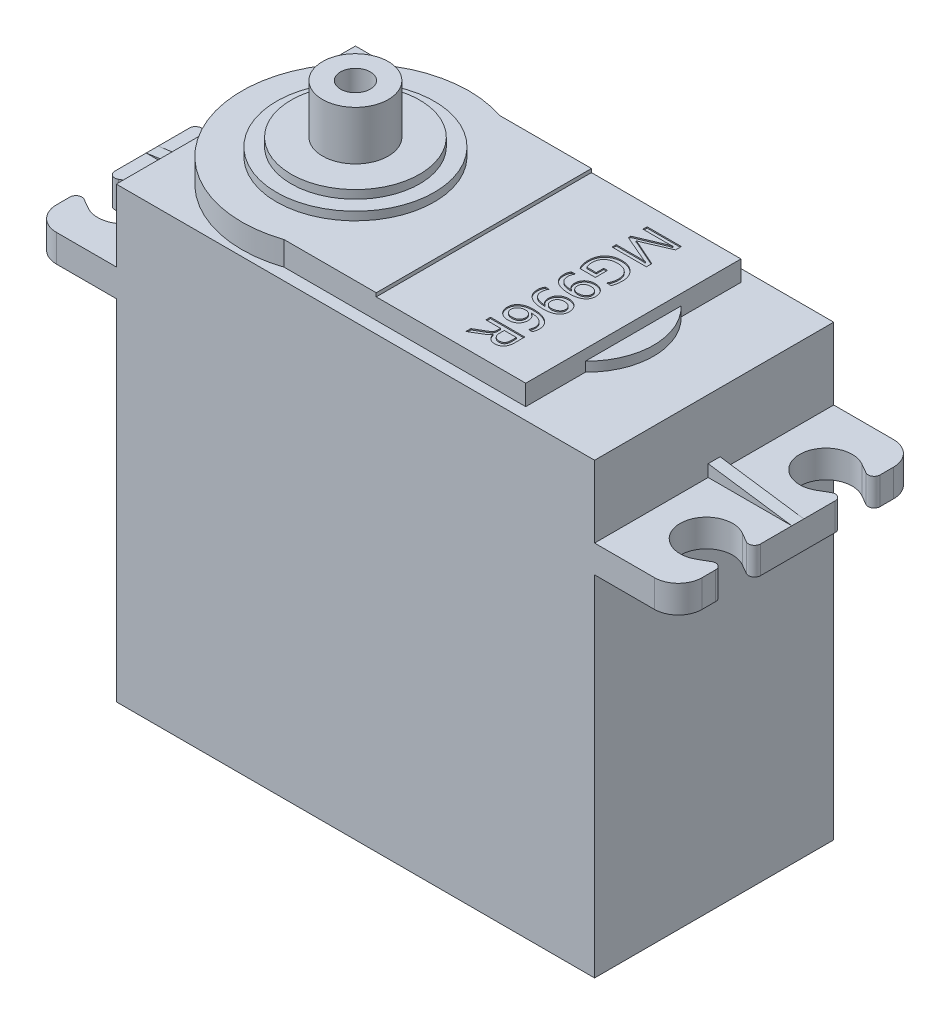
from build123d import *

# Parameters (mm, degrees)
SKETCH_1_W          = 40
SKETCH_1_H          = 20
EXTRUDE_1_DEPTH     = 37.5
EXTRUDE_2_DEPTH     = 2.3
CUT_EXTRUDE_1_REACH = 51.611
EXTRUDE_3_DEPTH     = 0.5
EXTRUDE_4_DEPTH     = 2
SKETCH_9_W          = 12.5
SKETCH_9_H          = 18
EXTRUDE_5_DEPTH     = 1.7
EXTRUDE_6_DEPTH     = 0.8
SKETCH_11_R         = 6.6
EXTRUDE_7_DEPTH     = 0.7
SKETCH_12_R         = 5.375
EXTRUDE_8_DEPTH     = 0.7
SKETCH_13_R         = 2.75
SKETCH_13_R_2       = 1.25
EXTRUDE_9_DEPTH     = 4.1
SKETCH_14_W         = 7
SKETCH_14_H         = 2.5
EXTRUDE_10_DEPTH    = 5
CUT_EXTRUDE_2_DEPTH = 0.1


with BuildPart() as part:
    # 草图1 → 凸台-拉伸1 (new body)
    with BuildSketch(Plane(origin=(0, 0, 0), x_dir=(1, 0, 0), z_dir=(0, 1, 0))):
        with Locations((10, 0)):
            Rectangle(SKETCH_1_W, SKETCH_1_H)
    extrude(amount=EXTRUDE_1_DEPTH)

    # 草图2 → 凸台-拉伸2 (add)
    with BuildSketch(Plane(origin=(0, 31.5, 0), x_dir=(1, 0, 0), z_dir=(0, 1, 0))):
        with BuildLine():
            Line((-10, 10), (-15, 10))
            ThreePointArc((-15, 10), (-16.414213562, 9.414213562), (-17, 8))
            Line((-17, 8), (-17, -8))
            ThreePointArc((-17, -8), (-16.414213562, -9.414213562), (-15, -10))
            Line((-15, -10), (-10, -10))
            Line((-10, -10), (-10, 10))
        make_face()
        with BuildLine():
            Line((37, 8), (37, -8))
            ThreePointArc((37, -8), (36.414213562, -9.414213562), (35, -10))
            Line((35, -10), (30, -10))
            Line((30, -10), (30, 10))
            Line((30, 10), (35, 10))
            ThreePointArc((35, 10), (36.414213562, 9.414213562), (37, 8))
        make_face()
    extrude(amount=-EXTRUDE_2_DEPTH)

    # 草图3 → 切除-拉伸1 (cut, up to next)
    with BuildSketch(Plane(origin=(0, 31.5, 0), x_dir=(1, 0, 0), z_dir=(0, 1, 0)), mode=Mode.PRIVATE) as cut_extrude_1_sk1:
        with BuildLine():
            Line((-16.25, 3.556624327), (-15.45, 3.094744112))
            ThreePointArc((-15.45, 3.094744112), (-12.15, 5), (-15.45, 6.905255888))
            Line((-15.45, 6.905255888), (-16.25, 6.443375673))
            ThreePointArc((-16.25, 6.443375673), (-16.75, 6.443375673), (-17, 6.876388375))
            Line((-17, 6.876388375), (-17, 3.123611625))
            ThreePointArc((-17, 3.123611625), (-16.75, 3.556624327), (-16.25, 3.556624327))
        make_face()
    cut_extrude_1_tool1 = extrude(cut_extrude_1_sk1.sketch, amount=-CUT_EXTRUDE_1_REACH, mode=Mode.PRIVATE) & part.part
    # 草图3 → 切除-拉伸1 (cut, up to next)
    with BuildSketch(Plane(origin=(0, 31.5, 0), x_dir=(1, 0, 0), z_dir=(0, 1, 0)), mode=Mode.PRIVATE) as cut_extrude_1_sk2:
        with BuildLine():
            ThreePointArc((-16.25, -3.556624327), (-16.75, -3.556624327), (-17, -3.123611625))
            Line((-17, -3.123611625), (-17, -6.876388375))
            ThreePointArc((-17, -6.876388375), (-16.75, -6.443375673), (-16.25, -6.443375673))
            Line((-16.25, -6.443375673), (-15.45, -6.905255888))
            ThreePointArc((-15.45, -6.905255888), (-12.15, -5), (-15.45, -3.094744112))
            Line((-15.45, -3.094744112), (-16.25, -3.556624327))
        make_face()
    cut_extrude_1_tool2 = extrude(cut_extrude_1_sk2.sketch, amount=-CUT_EXTRUDE_1_REACH, mode=Mode.PRIVATE) & part.part
    # 草图3 → 切除-拉伸1 (cut, up to next)
    with BuildSketch(Plane(origin=(0, 31.5, 0), x_dir=(1, 0, 0), z_dir=(0, 1, 0)), mode=Mode.PRIVATE) as cut_extrude_1_sk3:
        with BuildLine():
            Line((36.25, -3.556624327), (35.45, -3.094744112))
            ThreePointArc((35.45, -3.094744112), (32.15, -5), (35.45, -6.905255888))
            Line((35.45, -6.905255888), (36.25, -6.443375673))
            ThreePointArc((36.25, -6.443375673), (36.75, -6.443375673), (37, -6.876388375))
            Line((37, -6.876388375), (37, -3.123611625))
            ThreePointArc((37, -3.123611625), (36.75, -3.556624327), (36.25, -3.556624327))
        make_face()
    cut_extrude_1_tool3 = extrude(cut_extrude_1_sk3.sketch, amount=-CUT_EXTRUDE_1_REACH, mode=Mode.PRIVATE) & part.part
    # 草图3 → 切除-拉伸1 (cut, up to next)
    with BuildSketch(Plane(origin=(0, 31.5, 0), x_dir=(1, 0, 0), z_dir=(0, 1, 0)), mode=Mode.PRIVATE) as cut_extrude_1_sk4:
        with BuildLine():
            Line((37, 3.123611625), (37, 6.876388375))
            ThreePointArc((37, 6.876388375), (36.75, 6.443375673), (36.25, 6.443375673))
            Line((36.25, 6.443375673), (35.45, 6.905255888))
            ThreePointArc((35.45, 6.905255888), (32.15, 5), (35.45, 3.094744112))
            Line((35.45, 3.094744112), (36.25, 3.556624327))
            ThreePointArc((36.25, 3.556624327), (36.75, 3.556624327), (37, 3.123611625))
        make_face()
    cut_extrude_1_tool4 = extrude(cut_extrude_1_sk4.sketch, amount=-CUT_EXTRUDE_1_REACH, mode=Mode.PRIVATE) & part.part
    add(cut_extrude_1_tool1.solids().sort_by_distance((-14.604409, 31.5, -5))[0], mode=Mode.SUBTRACT)
    add(cut_extrude_1_tool2.solids().sort_by_distance((-14.604409, 31.5, 5))[0], mode=Mode.SUBTRACT)
    add(cut_extrude_1_tool3.solids().sort_by_distance((34.604409, 31.5, 5))[0], mode=Mode.SUBTRACT)
    add(cut_extrude_1_tool4.solids().sort_by_distance((34.604409, 31.5, -5))[0], mode=Mode.SUBTRACT)

    # 草图5 → 凸台-拉伸3 (add, symmetric)
    with BuildSketch(Plane.XY):
        Polygon((-10, 31.5), (-10, 32.5), (-17, 31.5), align=None)
        Polygon((37, 31.5), (30, 31.5), (30, 32.5), align=None)
    extrude(amount=EXTRUDE_3_DEPTH, both=True)

    # 草图8 → 凸台-拉伸4 (add)
    with BuildSketch(Plane(origin=(0, 37.5, 0), x_dir=(1, 0, 0), z_dir=(0, 1, 0))):
        with BuildLine():
            Line((10.741381265, -9), (10.741381265, 9))
            Line((10.741381265, 9), (3.041381265, 9))
            ThreePointArc((3.041381265, 9), (-9.5, 0), (3.041381265, -9))
            Line((3.041381265, -9), (10.741381265, -9))
        make_face()
    extrude(amount=EXTRUDE_4_DEPTH)

    # 草图9 → 凸台-拉伸5 (add)
    with BuildSketch(Plane(origin=(0, 37.5, 0), x_dir=(1, 0, 0), z_dir=(0, 1, 0))):
        with Locations((16.991381265, 0)):
            Rectangle(SKETCH_9_W, SKETCH_9_H)
    extrude(amount=EXTRUDE_5_DEPTH)

    # 草图10 → 凸台-拉伸6 (add)
    with BuildSketch(Plane(origin=(0, 37.5, 0), x_dir=(1, 0, 0), z_dir=(0, 1, 0))):
        with BuildLine():
            Line((23.241381265, 4), (23.241381265, -4))
            ThreePointArc((23.241381265, -4), (24.941381265, 0), (23.241381265, 4))
        make_face()
    extrude(amount=EXTRUDE_6_DEPTH)

    # 草图11 → 凸台-拉伸7 (add)
    with BuildSketch(Plane(origin=(0, 39.5, 0), x_dir=(1, 0, 0), z_dir=(0, 1, 0))):
        Circle(SKETCH_11_R)
    extrude(amount=EXTRUDE_7_DEPTH)

    # 草图12 → 凸台-拉伸8 (add)
    with BuildSketch(Plane(origin=(0, 40.2, 0), x_dir=(1, 0, 0), z_dir=(0, 1, 0))):
        Circle(SKETCH_12_R)
    extrude(amount=EXTRUDE_8_DEPTH)

    # 草图13 → 凸台-拉伸9 (add)
    with BuildSketch(Plane(origin=(0, 40.9, 0), x_dir=(1, 0, 0), z_dir=(0, 1, 0))):
        Circle(SKETCH_13_R)
        Circle(SKETCH_13_R_2, mode=Mode.SUBTRACT)
    extrude(amount=EXTRUDE_9_DEPTH)

    # 草图14 → 凸台-拉伸10 (add)
    with BuildSketch(Plane.ZY.offset(10)):
        with Locations((0, 5.45)):
            Rectangle(SKETCH_14_W, SKETCH_14_H)
    extrude(amount=EXTRUDE_10_DEPTH)

    # 草图15 → 切除-拉伸2 (cut)
    # profile 1 of 6: a face of its own
    with BuildSketch(Plane(origin=(0, 39.2, 0), x_dir=(1, 0, 0), z_dir=(0, 1, 0))):
        with BuildLine():
            Line((16.991381265, 4.820906972), (18.90347786, 4.820906972))
            add(Edge.make_bspline(
                [(18.90347786, 4.820906972), (18.944785821, 4.820602076), (19.031619537, 4.81996115), (19.167731971, 4.813944454), (19.315863325, 4.805322095), (19.418404861, 4.797259538), (19.471702968, 4.793068855)],
                knots=[0, 0, 0, 0, 0.871045541, 1.831030101, 2.872632534, 4, 4, 4, 4], degree=3))
            Line((19.471702968, 4.793068855), (19.471702968, 4.802348227))
            add(Edge.make_bspline(
                [(19.471702968, 4.802348227), (19.439450558, 4.80998736), (19.380222909, 4.824015702), (19.299536507, 4.845848836), (19.234457736, 4.865853175), (19.197068666, 4.880927735), (19.180767346, 4.887500117)],
                knots=[0, 0, 0, 0, 1.310468131, 2.406516137, 3.305254436, 4, 4, 4, 4], degree=3))
            Line((19.180767346, 4.887500117), (16.991381265, 5.833996119))
            Line((16.991381265, 5.833996119), (16.991381265, 6.04360077))
            Line((16.991381265, 6.04360077), (19.164391983, 6.972629718))
            add(Edge.make_bspline(
                [(19.164391983, 6.972629718), (19.17146746, 6.97559055), (19.186931899, 6.982061862), (19.212863799, 6.991539924), (19.244081475, 7.000308192), (19.279982733, 7.010933396), (19.320978995, 7.021667165), (19.366747321, 7.033318256), (19.417682365, 7.044423493), (19.453150832, 7.052477295), (19.471702968, 7.056689916)],
                knots=[0, 0, 0, 0, 0.577058856, 1.261242383, 2.075487777, 3.015664153, 4.078227724, 5.263505528, 6.568649248, 8, 8, 8, 8], degree=3))
            Line((19.471702968, 7.056689916), (19.471702968, 7.067606825))
            add(Edge.make_bspline(
                [(19.471702968, 7.067606825), (19.454056417, 7.066645912), (19.416774757, 7.064615802), (19.357814195, 7.062490703), (19.293211356, 7.061072211), (19.222805402, 7.059178772), (19.146923981, 7.058378339), (19.065233903, 7.057065337), (18.977895284, 7.056585532), (18.917669817, 7.056654359), (18.886556651, 7.056689916)],
                knots=[0, 0, 0, 0, 0.72463438, 1.530926509, 2.41901435, 3.374227338, 4.418811281, 5.530533762, 6.724245498, 8, 8, 8, 8], degree=3))
            Line((18.886556651, 7.056689916), (16.991381265, 7.056689916))
            Line((16.991381265, 7.056689916), (16.991381265, 7.406031001))
            Line((16.991381265, 7.406031001), (19.855978162, 7.406031001))
            Line((19.855978162, 7.406031001), (19.855978162, 6.916953482))
            Line((19.855978162, 6.916953482), (17.900213931, 6.069255506))
            add(Edge.make_bspline(
                [(17.900213931, 6.069255506), (17.864843294, 6.05423999), (17.79882865, 6.026215504), (17.704778738, 5.991032545), (17.624078689, 5.961586538), (17.573343512, 5.947787665), (17.550327001, 5.941527672)],
                knots=[0, 0, 0, 0, 1.236723759, 2.308182252, 3.232490273, 4, 4, 4, 4], degree=3))
            Line((17.550327001, 5.941527672), (17.550327001, 5.928427381))
            add(Edge.make_bspline(
                [(17.550327001, 5.928427381), (17.571424031, 5.920579321), (17.611782064, 5.905566199), (17.669765881, 5.884430922), (17.722287226, 5.864614142), (17.769674059, 5.846808157), (17.811573277, 5.83027551), (17.848423533, 5.816148805), (17.879825961, 5.803585978), (17.899120014, 5.795963217), (17.907855768, 5.792511865)],
                knots=[0, 0, 0, 0, 1.412333924, 2.701755703, 3.872234093, 4.93449088, 5.877898284, 6.698355401, 7.41065537, 8, 8, 8, 8], degree=3))
            Line((17.907855768, 5.792511865), (19.855978162, 4.925709298))
            Line((19.855978162, 4.925709298), (19.855978162, 4.471565888))
            Line((19.855978162, 4.471565888), (16.991381265, 4.471565888))
            Line((16.991381265, 4.471565888), (16.991381265, 4.820906972))
        make_face()
    # profile 2 of 6: a face of its own
    with BuildSketch(Plane(origin=(0, 39.2, 0), x_dir=(1, 0, 0), z_dir=(0, 1, 0))):
        with BuildLine():
            add(Edge.make_bspline(
                [(17.197164998, 1.572034882), (17.177943098, 1.608003366), (17.139515576, 1.679909876), (17.090438998, 1.792278061), (17.048932186, 1.908099462), (17.015066956, 2.027372077), (16.98878819, 2.149907572), (16.970513789, 2.275926743), (16.958549803, 2.405310031), (16.957153045, 2.492849343), (16.956447157, 2.53708963)],
                knots=[0, 0, 0, 0, 0.972956917, 1.945089931, 2.922975691, 3.907088372, 4.901795918, 5.911328761, 6.94443522, 8, 8, 8, 8], degree=3))
            add(Edge.make_bspline(
                [(16.956447157, 2.53708963), (16.957483672, 2.587372103), (16.959515312, 2.685929076), (16.97886316, 2.829809377), (17.008304229, 2.966536215), (17.05097799, 3.095636325), (17.106707095, 3.216791536), (17.173282371, 3.33123938), (17.253093934, 3.437516993), (17.344279187, 3.535655705), (17.445391271, 3.624489884), (17.555739995, 3.701958559), (17.674510244, 3.767040807), (17.800907779, 3.820932892), (17.9359781, 3.861519035), (18.07849407, 3.891738442), (18.229652774, 3.909202047), (18.333024604, 3.911461753), (18.386016378, 3.912620152)],
                knots=[0, 0, 0, 0, 1.078644858, 2.114215231, 3.110006391, 4.076918197, 5.025785053, 5.967440748, 6.913241114, 7.872075912, 8.837851529, 9.796630661, 10.759654955, 11.739538243, 12.740095881, 13.78169353, 14.862823715, 16, 16, 16, 16], degree=3))
            add(Edge.make_bspline(
                [(18.386016378, 3.912620152), (18.439753146, 3.911417874), (18.545052176, 3.909061971), (18.699284205, 3.88892114), (18.846001566, 3.856265279), (18.985769807, 3.81103575), (19.11793998, 3.751668753), (19.242770351, 3.679296657), (19.36056687, 3.594309231), (19.468850195, 3.496050301), (19.567921393, 3.388747201), (19.65492779, 3.273079072), (19.727867557, 3.149382342), (19.787541476, 3.018335314), (19.834051218, 2.880030258), (19.867385638, 2.734537548), (19.887290692, 2.581675646), (19.889689833, 2.477288259), (19.89091227, 2.424099622)],
                knots=[0, 0, 0, 0, 1.086135263, 2.128319124, 3.138636128, 4.121667084, 5.093204255, 6.062391405, 7.034457767, 8.024314098, 9.013678113, 9.983402714, 10.944921425, 11.911269802, 12.889636454, 13.890005454, 14.92489184, 16, 16, 16, 16], degree=3))
            add(Edge.make_bspline(
                [(19.89091227, 2.424099622), (19.890559468, 2.386423346), (19.88986514, 2.312274862), (19.882431337, 2.20338058), (19.871334175, 2.098758749), (19.854753191, 1.998794392), (19.834343538, 1.902996114), (19.808409321, 1.811810253), (19.77891761, 1.724544639), (19.75449684, 1.669214868), (19.742442309, 1.641903099)],
                knots=[0, 0, 0, 0, 1.126842671, 2.217673442, 3.26348751, 4.272790695, 5.247453918, 6.191690212, 7.107385799, 8, 8, 8, 8], degree=3))
            Line((19.742442309, 1.641903099), (19.358167116, 1.641903099))
            add(Edge.make_bspline(
                [(19.358167116, 1.641903099), (19.375775478, 1.67091846), (19.410999293, 1.728960867), (19.454938804, 1.821460116), (19.492834866, 1.917486937), (19.523181444, 2.017796213), (19.547514752, 2.121852398), (19.564014828, 2.230270321), (19.574853153, 2.342729179), (19.575949178, 2.419161008), (19.576505294, 2.45794204)],
                knots=[0, 0, 0, 0, 0.950725749, 1.90183437, 2.865870166, 3.841809745, 4.836370993, 5.858387711, 6.913359333, 8, 8, 8, 8], degree=3))
            add(Edge.make_bspline(
                [(19.576505294, 2.45794204), (19.575655871, 2.496024802), (19.573990456, 2.570691456), (19.558110534, 2.680000412), (19.533104099, 2.784233858), (19.498283659, 2.883626413), (19.452437352, 2.977489154), (19.397168473, 3.066329014), (19.331591113, 3.149900673), (19.256454389, 3.227447372), (19.173563678, 3.298258155), (19.083130515, 3.359712199), (18.986943329, 3.412357019), (18.883978476, 3.455291986), (18.774450085, 3.48771634), (18.658652212, 3.51111746), (18.536669274, 3.525548489), (18.453195514, 3.527399802), (18.410579423, 3.528344958)],
                knots=[0, 0, 0, 0, 1.028083989, 2.015704404, 2.976437228, 3.919933104, 4.854077463, 5.792285161, 6.740988825, 7.717641351, 8.704332033, 9.680329, 10.665586668, 11.661341596, 12.687520919, 13.745795982, 14.849154938, 16, 16, 16, 16], degree=3))
            add(Edge.make_bspline(
                [(18.410579423, 3.528344958), (18.366876091, 3.527559858), (18.281629375, 3.526028459), (18.157746997, 3.512617224), (18.041206108, 3.491612333), (17.931943567, 3.46178139), (17.830203847, 3.422348156), (17.735791687, 3.374747771), (17.648587853, 3.318967112), (17.570207743, 3.253668078), (17.499644336, 3.181706963), (17.438030099, 3.103345994), (17.386414745, 3.018583282), (17.344374159, 2.927828137), (17.310645056, 2.831238769), (17.287521812, 2.728315151), (17.273760121, 2.619340162), (17.27183939, 2.544772486), (17.270854133, 2.506522285)],
                knots=[0, 0, 0, 0, 1.21008622, 2.36036639, 3.446609172, 4.487011279, 5.492081308, 6.463398055, 7.411094352, 8.352459205, 9.282534545, 10.197858517, 11.107044583, 12.024599146, 12.963262571, 13.935102051, 14.940790899, 16, 16, 16, 16], degree=3))
            add(Edge.make_bspline(
                [(17.270854133, 2.506522285), (17.271298006, 2.480127894), (17.272171603, 2.428180442), (17.278335256, 2.351654443), (17.287965559, 2.27818874), (17.301650694, 2.207596393), (17.31949403, 2.140284361), (17.341572478, 2.075985554), (17.367001308, 2.014555075), (17.38737253, 1.975638644), (17.397490276, 1.956310076)],
                knots=[0, 0, 0, 0, 1.110065811, 2.184747887, 3.227007212, 4.225063257, 5.207029156, 6.153277384, 7.082790902, 8, 8, 8, 8], degree=3))
            Line((17.397490276, 1.956310076), (18.179140954, 1.956310076))
            Line((18.179140954, 1.956310076), (18.179140954, 2.585124029))
            Line((18.179140954, 2.585124029), (18.49354793, 2.585124029))
            Line((18.49354793, 2.585124029), (18.49354793, 1.572034882))
            Line((18.49354793, 1.572034882), (17.197164998, 1.572034882))
        make_face()
    # profile 3 of 6: a face of its own
    with BuildSketch(Plane(origin=(0, 39.2, 0), x_dir=(1, 0, 0), z_dir=(0, 1, 0))):
        with BuildLine():
            add(Edge.make_bspline(
                [(17.419324094, 0.978155038), (17.407364808, 0.958496955), (17.383684775, 0.919572889), (17.353934781, 0.858562657), (17.327799447, 0.79679044), (17.307468649, 0.733460225), (17.290582313, 0.669230301), (17.279564407, 0.60381297), (17.271903081, 0.537293759), (17.271206021, 0.4925569), (17.270854133, 0.469972928)],
                knots=[0, 0, 0, 0, 1.028585653, 2.036655077, 3.032564308, 4.025876988, 5.00876855, 6.000112653, 6.990420851, 8, 8, 8, 8], degree=3))
            add(Edge.make_bspline(
                [(17.270854133, 0.469972928), (17.271528286, 0.438794842), (17.272840801, 0.378093909), (17.287835298, 0.289932516), (17.310357689, 0.20696574), (17.342801526, 0.129318688), (17.384680307, 0.057387795), (17.435454942, -0.009527866), (17.495764545, -0.070589779), (17.565060431, -0.126013797), (17.64295568, -0.174859323), (17.728285646, -0.218246376), (17.82184703, -0.254206345), (17.922968217, -0.28319483), (18.031547297, -0.307055449), (18.148012461, -0.322828496), (18.27212029, -0.332882667), (18.357429588, -0.334018932), (18.40130005, -0.334603258)],
                knots=[0, 0, 0, 0, 0.954567611, 1.858457354, 2.732422706, 3.584719473, 4.429228195, 5.276824037, 6.152193579, 7.052654035, 7.990113814, 8.965178141, 9.98206079, 11.056699865, 12.186517323, 13.385963841, 14.655727156, 16, 16, 16, 16], degree=3))
            add(Edge.make_bspline(
                [(18.40130005, -0.334603258), (18.400444358, -0.333320513), (18.398834945, -0.330907888), (18.400513806, -0.328591894), (18.40130005, -0.327507267)],
                knots=[0, 0, 0, 0, 1.063360139, 2, 2, 2, 2], degree=3))
            add(Edge.make_bspline(
                [(18.40130005, -0.327507267), (18.372590231, -0.311555121), (18.316442545, -0.280357568), (18.242390035, -0.221156348), (18.179010056, -0.154620112), (18.127975332, -0.079341884), (18.087515102, 0.003442401), (18.059437893, 0.094391348), (18.042111123, 0.193113458), (18.040326647, 0.261566727), (18.03940452, 0.296939922)],
                knots=[0, 0, 0, 0, 1.030533739, 2.015410951, 2.965883311, 3.907857419, 4.861625629, 5.850725502, 6.889363418, 8, 8, 8, 8], degree=3))
            add(Edge.make_bspline(
                [(18.03940452, 0.296939922), (18.040126812, 0.32590446), (18.041545482, 0.382794331), (18.053072781, 0.466279957), (18.07303546, 0.545662683), (18.09951643, 0.621701873), (18.135039212, 0.693549079), (18.177487953, 0.76201429), (18.228268602, 0.826207934), (18.285919562, 0.885917508), (18.349541927, 0.940440662), (18.418542133, 0.988274624), (18.492692128, 1.028084585), (18.571119892, 1.060924774), (18.654026566, 1.086870508), (18.741674409, 1.104466146), (18.833863076, 1.115732311), (18.896893667, 1.117160818), (18.929132596, 1.117891472)],
                knots=[0, 0, 0, 0, 1.024075968, 2.011409591, 2.972737173, 3.915012034, 4.853147525, 5.801204611, 6.758907623, 7.741849386, 8.732197648, 9.717432345, 10.704954653, 11.702799665, 12.720386372, 13.771575185, 14.860203789, 16, 16, 16, 16], degree=3))
            add(Edge.make_bspline(
                [(18.929132596, 1.117891472), (18.963373759, 1.117220031), (19.030620106, 1.115901387), (19.129115831, 1.103690876), (19.222951265, 1.083383971), (19.312305359, 1.055735895), (19.396873451, 1.019592966), (19.476349342, 0.974900341), (19.551625555, 0.923031168), (19.620984874, 0.863042848), (19.684313162, 0.797293939), (19.739870136, 0.726117445), (19.786445815, 0.64961675), (19.824880193, 0.568630662), (19.854379222, 0.482703752), (19.875732479, 0.39223545), (19.888360875, 0.296932459), (19.89005131, 0.231840111), (19.89091227, 0.198687742)],
                knots=[0, 0, 0, 0, 1.100355813, 2.160992814, 3.184300223, 4.183247733, 5.163214011, 6.134660359, 7.109762209, 8.096893554, 9.077296099, 10.040164893, 10.993123417, 11.950701635, 12.916249136, 13.907909978, 14.934471686, 16, 16, 16, 16], degree=3))
            add(Edge.make_bspline(
                [(19.89091227, 0.198687742), (19.889814321, 0.164428608), (19.887671288, 0.097559875), (19.87236885, -3.9446e-05), (19.84581303, -0.091671316), (19.809989946, -0.178236528), (19.762475053, -0.258464468), (19.704495097, -0.332718407), (19.636365784, -0.40128818), (19.557840144, -0.463517871), (19.46974124, -0.519318456), (19.371687018, -0.567322578), (19.264445718, -0.608232579), (19.147623888, -0.641164673), (19.021621403, -0.667434012), (18.886086829, -0.685591936), (18.740996966, -0.696525227), (18.641128127, -0.697948209), (18.589616729, -0.69868217)],
                knots=[0, 0, 0, 0, 0.92240419, 1.800395753, 2.651735748, 3.486158885, 4.316356776, 5.154296614, 6.016952827, 6.912968287, 7.846765804, 8.819630126, 9.847832232, 10.933373702, 12.08453234, 13.310968928, 14.61302334, 16, 16, 16, 16], degree=3))
            add(Edge.make_bspline(
                [(18.589616729, -0.69868217), (18.52590289, -0.697811206), (18.402116557, -0.696119054), (18.222237494, -0.681001837), (18.053499863, -0.657475851), (17.896121187, -0.623955473), (17.749977389, -0.580350528), (17.615223312, -0.526729875), (17.491151953, -0.464363241), (17.379341029, -0.391390772), (17.279794611, -0.310287678), (17.193126599, -0.221215628), (17.119854617, -0.124464927), (17.060034678, -0.020032946), (17.013237466, 0.091799576), (16.980015832, 0.210937956), (16.959988986, 0.337564177), (16.957646578, 0.42441142), (16.956447157, 0.468881237)],
                knots=[0, 0, 0, 0, 1.35028008, 2.623389572, 3.823303126, 4.959469995, 6.03073553, 7.051988269, 8.029948387, 8.969148067, 9.876285298, 10.746329479, 11.597116086, 12.441902515, 13.290667489, 14.160001915, 15.057835605, 16, 16, 16, 16], degree=3))
            add(Edge.make_bspline(
                [(16.956447157, 0.468881237), (16.956800386, 0.493463867), (16.957495309, 0.54182629), (16.964926903, 0.61274474), (16.976179355, 0.681038821), (16.9926513, 0.746306622), (17.013126252, 0.808938523), (17.039385957, 0.868131193), (17.068798053, 0.925251965), (17.092897994, 0.9605508), (17.104917118, 0.978155038)],
                knots=[0, 0, 0, 0, 1.093805841, 2.151889375, 3.170429105, 4.172184366, 5.145378569, 6.09927475, 7.052070148, 8, 8, 8, 8], degree=3))
            Line((17.104917118, 0.978155038), (17.419324094, 0.978155038))
        make_face()
        with BuildLine():
            add(Edge.make_bspline(
                [(18.97061685, 0.733616278), (18.947496689, 0.733200973), (18.902432633, 0.732391492), (18.836667213, 0.725992006), (18.774918245, 0.714258287), (18.71646966, 0.699293927), (18.661879712, 0.678980684), (18.6107949, 0.654447811), (18.563541529, 0.625196256), (18.519937819, 0.5922227), (18.480889567, 0.554882865), (18.446970172, 0.51374088), (18.41797749, 0.469485023), (18.393900625, 0.421833555), (18.376398469, 0.370452539), (18.363017568, 0.316068352), (18.355423651, 0.258216188), (18.354358944, 0.218541638), (18.353811497, 0.198141897)],
                knots=[0, 0, 0, 0, 1.201614023, 2.342094608, 3.429014088, 4.465821748, 5.474161983, 6.451195725, 7.40652364, 8.357911654, 9.287620349, 10.207853812, 11.123264036, 12.032547768, 12.97467861, 13.938023664, 14.939779185, 16, 16, 16, 16], degree=3))
            add(Edge.make_bspline(
                [(18.353811497, 0.198141897), (18.35416221, 0.180284285), (18.3548487, 0.145329634), (18.36229245, 0.093960655), (18.374024492, 0.044849962), (18.391369281, -0.001988907), (18.412666672, -0.046773437), (18.438143361, -0.089892803), (18.470020247, -0.129571972), (18.504839818, -0.167793694), (18.544081899, -0.201629689), (18.585183217, -0.231970664), (18.628117301, -0.257879289), (18.673652055, -0.277901024), (18.720565544, -0.29472105), (18.770068957, -0.305846321), (18.821370571, -0.313346119), (18.856325546, -0.314050681), (18.874002206, -0.314406976)],
                knots=[0, 0, 0, 0, 1.052405084, 2.059987197, 3.054110504, 4.024913866, 4.999209444, 5.97633694, 6.970112753, 7.995084367, 9.021627336, 10.019565095, 11.005898532, 11.971171561, 12.948475779, 13.94010602, 14.95831579, 16, 16, 16, 16], degree=3))
            add(Edge.make_bspline(
                [(18.874002206, -0.314406976), (18.89876524, -0.314047726), (18.947487702, -0.313340884), (19.018791875, -0.306010992), (19.086817517, -0.294596454), (19.15156521, -0.278993177), (19.212921101, -0.257888263), (19.2714876, -0.23319111), (19.326256422, -0.20277253), (19.377489867, -0.168575068), (19.424154151, -0.130821603), (19.465194058, -0.089740728), (19.499028992, -0.044937068), (19.527830951, 0.001963227), (19.54997049, 0.052249172), (19.565001767, 0.105560582), (19.574609185, 0.161589897), (19.575865776, 0.199921661), (19.576505294, 0.219429869)],
                knots=[0, 0, 0, 0, 1.20492916, 2.370756203, 3.484529756, 4.560627125, 5.608027333, 6.639469169, 7.65017253, 8.652303849, 9.634315796, 10.567389382, 11.470739043, 12.360750364, 13.241059671, 14.135159179, 15.050925415, 16, 16, 16, 16], degree=3))
            add(Edge.make_bspline(
                [(19.576505294, 0.219429869), (19.57600458, 0.237656084), (19.575022895, 0.27338984), (19.566585016, 0.325766916), (19.552864048, 0.37546873), (19.534388927, 0.423178698), (19.509312201, 0.467832256), (19.480002141, 0.511001619), (19.443923903, 0.550620445), (19.403771243, 0.588299619), (19.359473353, 0.622218326), (19.312032982, 0.652155989), (19.261782698, 0.676986833), (19.209012829, 0.698209607), (19.153110067, 0.713759524), (19.094702201, 0.725106045), (19.033582361, 0.732601423), (18.991927539, 0.733272801), (18.97061685, 0.733616278)],
                knots=[0, 0, 0, 0, 0.985572672, 1.932283465, 2.861223772, 3.771514896, 4.692230854, 5.626060628, 6.588202423, 7.584141594, 8.602020808, 9.601601628, 10.614088255, 11.6303956, 12.67421699, 13.747557175, 14.847645819, 16, 16, 16, 16], degree=3))
        make_face(mode=Mode.SUBTRACT)
    # profile 4 of 6: a face of its own
    with BuildSketch(Plane(origin=(0, 39.2, 0), x_dir=(1, 0, 0), z_dir=(0, 1, 0))):
        with BuildLine():
            add(Edge.make_bspline(
                [(17.419324094, -1.222693797), (17.407364808, -1.242351881), (17.383684775, -1.281275946), (17.353934781, -1.342286178), (17.327799447, -1.404058395), (17.307468649, -1.46738861), (17.290582313, -1.531618534), (17.279564407, -1.597035865), (17.271903081, -1.663555076), (17.271206021, -1.708291935), (17.270854133, -1.730875907)],
                knots=[0, 0, 0, 0, 1.028585653, 2.036655077, 3.032564308, 4.025876988, 5.00876855, 6.000112653, 6.990420851, 8, 8, 8, 8], degree=3))
            add(Edge.make_bspline(
                [(17.270854133, -1.730875907), (17.271528286, -1.762053994), (17.272840801, -1.822754926), (17.287835298, -1.910916319), (17.310357689, -1.993883095), (17.342801526, -2.071530147), (17.384680307, -2.143461041), (17.435454942, -2.210376701), (17.495764545, -2.271438614), (17.565060431, -2.326862633), (17.64295568, -2.375708159), (17.728285646, -2.419095211), (17.82184703, -2.45505518), (17.922968217, -2.484043665), (18.031547297, -2.507904285), (18.148012461, -2.523677331), (18.27212029, -2.533731502), (18.357429588, -2.534867767), (18.40130005, -2.535452093)],
                knots=[0, 0, 0, 0, 0.954567611, 1.858457354, 2.732422706, 3.584719473, 4.429228195, 5.276824037, 6.152193579, 7.052654035, 7.990113814, 8.965178141, 9.98206079, 11.056699865, 12.186517323, 13.385963841, 14.655727156, 16, 16, 16, 16], degree=3))
            add(Edge.make_bspline(
                [(18.40130005, -2.535452093), (18.400444358, -2.534169349), (18.398834945, -2.531756724), (18.400513806, -2.529440729), (18.40130005, -2.528356102)],
                knots=[0, 0, 0, 0, 1.063360139, 2, 2, 2, 2], degree=3))
            add(Edge.make_bspline(
                [(18.40130005, -2.528356102), (18.372590231, -2.512403956), (18.316442545, -2.481206404), (18.242390035, -2.422005184), (18.179010056, -2.355468948), (18.127975332, -2.280190719), (18.087515102, -2.197406434), (18.059437893, -2.106457487), (18.042111123, -2.007735377), (18.040326647, -1.939282108), (18.03940452, -1.903908913)],
                knots=[0, 0, 0, 0, 1.030533739, 2.015410951, 2.965883311, 3.907857419, 4.861625629, 5.850725502, 6.889363418, 8, 8, 8, 8], degree=3))
            add(Edge.make_bspline(
                [(18.03940452, -1.903908913), (18.040126812, -1.874944375), (18.041545482, -1.818054504), (18.053072781, -1.734568878), (18.07303546, -1.655186153), (18.09951643, -1.579146962), (18.135039212, -1.507299757), (18.177487953, -1.438834545), (18.228268602, -1.374640902), (18.285919562, -1.314931327), (18.349541927, -1.260408173), (18.418542133, -1.212574212), (18.492692128, -1.17276425), (18.571119892, -1.139924061), (18.654026566, -1.113978327), (18.741674409, -1.096382689), (18.833863076, -1.085116524), (18.896893667, -1.083688017), (18.929132596, -1.082957363)],
                knots=[0, 0, 0, 0, 1.024075968, 2.011409591, 2.972737173, 3.915012034, 4.853147525, 5.801204611, 6.758907623, 7.741849386, 8.732197648, 9.717432345, 10.704954653, 11.702799665, 12.720386372, 13.771575185, 14.860203789, 16, 16, 16, 16], degree=3))
            add(Edge.make_bspline(
                [(18.929132596, -1.082957363), (18.963373759, -1.083628804), (19.030620106, -1.084947448), (19.129115831, -1.097157959), (19.222951265, -1.117464864), (19.312305359, -1.14511294), (19.396873451, -1.181255869), (19.476349342, -1.225948495), (19.551625555, -1.277817667), (19.620984874, -1.337805987), (19.684313162, -1.403554896), (19.739870136, -1.47473139), (19.786445815, -1.551232085), (19.824880193, -1.632218173), (19.854379222, -1.718145083), (19.875732479, -1.808613385), (19.888360875, -1.903916376), (19.89005131, -1.969008724), (19.89091227, -2.002161093)],
                knots=[0, 0, 0, 0, 1.100355813, 2.160992814, 3.184300223, 4.183247733, 5.163214011, 6.134660359, 7.109762209, 8.096893554, 9.077296099, 10.040164893, 10.993123417, 11.950701635, 12.916249136, 13.907909978, 14.934471686, 16, 16, 16, 16], degree=3))
            add(Edge.make_bspline(
                [(19.89091227, -2.002161093), (19.889814321, -2.036420227), (19.887671288, -2.10328896), (19.87236885, -2.200888282), (19.84581303, -2.292520151), (19.809989946, -2.379085363), (19.762475053, -2.459313303), (19.704495097, -2.533567242), (19.636365784, -2.602137015), (19.557840144, -2.664366707), (19.46974124, -2.720167291), (19.371687018, -2.768171413), (19.264445718, -2.809081414), (19.147623888, -2.842013508), (19.021621403, -2.868282847), (18.886086829, -2.886440771), (18.740996966, -2.897374062), (18.641128127, -2.898797044), (18.589616729, -2.899531005)],
                knots=[0, 0, 0, 0, 0.92240419, 1.800395753, 2.651735748, 3.486158885, 4.316356776, 5.154296614, 6.016952827, 6.912968287, 7.846765804, 8.819630126, 9.847832232, 10.933373702, 12.08453234, 13.310968928, 14.61302334, 16, 16, 16, 16], degree=3))
            add(Edge.make_bspline(
                [(18.589616729, -2.899531005), (18.52590289, -2.898660041), (18.402116557, -2.896967889), (18.222237494, -2.881850672), (18.053499863, -2.858324686), (17.896121187, -2.824804309), (17.749977389, -2.781199363), (17.615223312, -2.72757871), (17.491151953, -2.665212076), (17.379341029, -2.592239607), (17.279794611, -2.511136514), (17.193126599, -2.422064463), (17.119854617, -2.325313763), (17.060034678, -2.220881781), (17.013237466, -2.109049259), (16.980015832, -1.989910879), (16.959988986, -1.863284658), (16.957646578, -1.776437416), (16.956447157, -1.731967598)],
                knots=[0, 0, 0, 0, 1.35028008, 2.623389572, 3.823303126, 4.959469995, 6.03073553, 7.051988269, 8.029948387, 8.969148067, 9.876285298, 10.746329479, 11.597116086, 12.441902515, 13.290667489, 14.160001915, 15.057835605, 16, 16, 16, 16], degree=3))
            add(Edge.make_bspline(
                [(16.956447157, -1.731967598), (16.956800386, -1.707384968), (16.957495309, -1.659022546), (16.964926903, -1.588104096), (16.976179355, -1.519810015), (16.9926513, -1.454542213), (17.013126252, -1.391910312), (17.039385957, -1.332717642), (17.068798053, -1.27559687), (17.092897994, -1.240298035), (17.104917118, -1.222693797)],
                knots=[0, 0, 0, 0, 1.093805841, 2.151889375, 3.170429105, 4.172184366, 5.145378569, 6.09927475, 7.052070148, 8, 8, 8, 8], degree=3))
            Line((17.104917118, -1.222693797), (17.419324094, -1.222693797))
        make_face()
        with BuildLine():
            add(Edge.make_bspline(
                [(18.97061685, -1.467232557), (18.947496689, -1.467647862), (18.902432633, -1.468457343), (18.836667213, -1.47485683), (18.774918245, -1.486590548), (18.71646966, -1.501554908), (18.661879712, -1.521868151), (18.6107949, -1.546401024), (18.563541529, -1.575652579), (18.519937819, -1.608626136), (18.480889567, -1.64596597), (18.446970172, -1.687107955), (18.41797749, -1.731363812), (18.393900625, -1.77901528), (18.376398469, -1.830396296), (18.363017568, -1.884780483), (18.355423651, -1.942632648), (18.354358944, -1.982307197), (18.353811497, -2.002706939)],
                knots=[0, 0, 0, 0, 1.201614023, 2.342094608, 3.429014088, 4.465821748, 5.474161983, 6.451195725, 7.40652364, 8.357911654, 9.287620349, 10.207853812, 11.123264036, 12.032547768, 12.97467861, 13.938023664, 14.939779185, 16, 16, 16, 16], degree=3))
            add(Edge.make_bspline(
                [(18.353811497, -2.002706939), (18.35416221, -2.020564551), (18.3548487, -2.055519201), (18.36229245, -2.106888181), (18.374024492, -2.155998873), (18.391369281, -2.202837742), (18.412666672, -2.247622272), (18.438143361, -2.290741638), (18.470020247, -2.330420807), (18.504839818, -2.368642529), (18.544081899, -2.402478525), (18.585183217, -2.432819499), (18.628117301, -2.458728124), (18.673652055, -2.47874986), (18.720565544, -2.495569885), (18.770068957, -2.506695156), (18.821370571, -2.514194954), (18.856325546, -2.514899516), (18.874002206, -2.515255812)],
                knots=[0, 0, 0, 0, 1.052405084, 2.059987197, 3.054110504, 4.024913866, 4.999209444, 5.97633694, 6.970112753, 7.995084367, 9.021627336, 10.019565095, 11.005898532, 11.971171561, 12.948475779, 13.94010602, 14.95831579, 16, 16, 16, 16], degree=3))
            add(Edge.make_bspline(
                [(18.874002206, -2.515255812), (18.89876524, -2.514896561), (18.947487702, -2.514189719), (19.018791875, -2.506859827), (19.086817517, -2.49544529), (19.15156521, -2.479842013), (19.212921101, -2.458737098), (19.2714876, -2.434039945), (19.326256422, -2.403621365), (19.377489867, -2.369423903), (19.424154151, -2.331670439), (19.465194058, -2.290589563), (19.499028992, -2.245785903), (19.527830951, -2.198885609), (19.54997049, -2.148599663), (19.565001767, -2.095288253), (19.574609185, -2.039258939), (19.575865776, -2.000927175), (19.576505294, -1.981418966)],
                knots=[0, 0, 0, 0, 1.20492916, 2.370756203, 3.484529756, 4.560627125, 5.608027333, 6.639469169, 7.65017253, 8.652303849, 9.634315796, 10.567389382, 11.470739043, 12.360750364, 13.241059671, 14.135159179, 15.050925415, 16, 16, 16, 16], degree=3))
            add(Edge.make_bspline(
                [(19.576505294, -1.981418966), (19.57600458, -1.963192752), (19.575022895, -1.927458996), (19.566585016, -1.87508192), (19.552864048, -1.825380105), (19.534388927, -1.777670137), (19.509312201, -1.73301658), (19.480002141, -1.689847217), (19.443923903, -1.65022839), (19.403771243, -1.612549216), (19.359473353, -1.578630509), (19.312032982, -1.548692847), (19.261782698, -1.523862002), (19.209012829, -1.502639229), (19.153110067, -1.487089311), (19.094702201, -1.47574279), (19.033582361, -1.468247412), (18.991927539, -1.467576035), (18.97061685, -1.467232557)],
                knots=[0, 0, 0, 0, 0.985572672, 1.932283465, 2.861223772, 3.771514896, 4.692230854, 5.626060628, 6.588202423, 7.584141594, 8.602020808, 9.601601628, 10.614088255, 11.6303956, 12.67421699, 13.747557175, 14.847645819, 16, 16, 16, 16], degree=3))
        make_face(mode=Mode.SUBTRACT)
    # profile 5 of 6: a face of its own
    with BuildSketch(Plane(origin=(0, 39.2, 0), x_dir=(1, 0, 0), z_dir=(0, 1, 0))):
        with BuildLine():
            add(Edge.make_bspline(
                [(19.462969441, -4.995577515), (19.48050191, -4.957746774), (19.515313993, -4.882630893), (19.550037457, -4.763906567), (19.572527332, -4.642909471), (19.575175481, -4.561185312), (19.576505294, -4.520146132)],
                knots=[0, 0, 0, 0, 1.013543852, 2.012470203, 3.001928032, 4, 4, 4, 4], degree=3))
            add(Edge.make_bspline(
                [(19.576505294, -4.520146132), (19.575605148, -4.489335813), (19.573841966, -4.428985411), (19.558718944, -4.340986762), (19.534057302, -4.257762425), (19.499491612, -4.178900463), (19.454278071, -4.105094706), (19.399689679, -4.03548193), (19.334861236, -3.971190204), (19.260877988, -3.911719246), (19.17883228, -3.857738393), (19.0884039, -3.811351794), (18.991236925, -3.771606122), (18.886810189, -3.738748865), (18.775252955, -3.713311287), (18.656330552, -3.694932023), (18.530344689, -3.68335939), (18.443901264, -3.681557819), (18.399662514, -3.680635837)],
                knots=[0, 0, 0, 0, 0.913296431, 1.788939818, 2.639222758, 3.482489816, 4.33487651, 5.199609904, 6.100158379, 7.036504938, 8.010893577, 9.007723269, 10.045938113, 11.121177943, 12.250898554, 13.436220282, 14.68794636, 16, 16, 16, 16], degree=3))
            Line((18.399662514, -3.680635837), (18.399662514, -3.68991521))
            add(Edge.make_bspline(
                [(18.399662514, -3.68991521), (18.432005862, -3.707479304), (18.494859285, -3.741611931), (18.578682566, -3.805166662), (18.649763346, -3.876364924), (18.707924044, -3.955487288), (18.753310924, -4.042093438), (18.784876303, -4.136825618), (18.804332835, -4.238969397), (18.806726816, -4.309724645), (18.807954907, -4.346021435)],
                knots=[0, 0, 0, 0, 1.077964415, 2.094828084, 3.071894335, 4.018375507, 4.963336831, 5.926673543, 6.936402618, 8, 8, 8, 8], degree=3))
            add(Edge.make_bspline(
                [(18.807954907, -4.346021435), (18.807252816, -4.376624356), (18.805881057, -4.436416954), (18.794251787, -4.523644786), (18.774960906, -4.605984072), (18.749155218, -4.68408562), (18.714286278, -4.756850194), (18.672642283, -4.825421418), (18.622615757, -4.888630684), (18.565931945, -4.947227135), (18.502477166, -4.999303053), (18.434263836, -5.045640289), (18.360349966, -5.083724385), (18.281914795, -5.115739019), (18.198266304, -5.140097653), (18.109651111, -5.157349811), (18.016231434, -5.168778469), (17.952104288, -5.169750894), (17.919318522, -5.170248057)],
                knots=[0, 0, 0, 0, 1.074298639, 2.098986157, 3.083092859, 4.040774774, 4.981035408, 5.910247383, 6.852221309, 7.805567045, 8.767586811, 9.729797503, 10.69571313, 11.681643251, 12.700578092, 13.749343062, 14.849324875, 16, 16, 16, 16], degree=3))
            add(Edge.make_bspline(
                [(17.919318522, -5.170248057), (17.884893745, -5.169587538), (17.817462124, -5.168293707), (17.718804155, -5.155998364), (17.624847708, -5.135904227), (17.535685979, -5.107424311), (17.450946809, -5.071261271), (17.370910863, -5.02695681), (17.295945761, -4.974182776), (17.226151618, -4.914354436), (17.163222363, -4.848019434), (17.107605009, -4.776952361), (17.061069247, -4.701006862), (17.022331089, -4.620884784), (16.993185478, -4.535922061), (16.971589446, -4.446803306), (16.95900592, -4.353113033), (16.957310744, -4.2891089), (16.956447157, -4.256502782)],
                knots=[0, 0, 0, 0, 1.109861097, 2.174007738, 3.200701264, 4.204722214, 5.187931194, 6.16771933, 7.149403559, 8.139801315, 9.127692435, 10.093747355, 11.044857751, 11.995008189, 12.958207171, 13.936025103, 14.948533366, 16, 16, 16, 16], degree=3))
            add(Edge.make_bspline(
                [(16.956447157, -4.256502782), (16.957485708, -4.2209603), (16.959520276, -4.151331041), (16.97574899, -4.049905135), (17.001667173, -3.954087634), (17.039164259, -3.864489959), (17.08700242, -3.780885923), (17.145335504, -3.703156481), (17.214968259, -3.63207409), (17.294124389, -3.566392064), (17.38345982, -3.508159229), (17.481826367, -3.457156843), (17.589239179, -3.414257922), (17.70516904, -3.378863966), (17.829844787, -3.351525339), (17.963462228, -3.333130861), (18.105759432, -3.320584175), (18.203675123, -3.319365622), (18.25392178, -3.318740307)],
                knots=[0, 0, 0, 0, 0.944653107, 1.850616283, 2.723875085, 3.57834348, 4.425659775, 5.279086604, 6.154968211, 7.06555713, 8.008883694, 8.984797083, 10.00717675, 11.079962804, 12.204518309, 13.397077347, 14.664277788, 16, 16, 16, 16], degree=3))
            add(Edge.make_bspline(
                [(18.25392178, -3.318740307), (18.314913283, -3.319532264), (18.434020477, -3.321078835), (18.607743998, -3.337505966), (18.772139863, -3.362702992), (18.926857076, -3.398391383), (19.071681062, -3.445130782), (19.207327407, -3.500903179), (19.332765051, -3.568622904), (19.448293073, -3.645088932), (19.552285382, -3.73005225), (19.64279234, -3.822473252), (19.719553217, -3.921487343), (19.782263195, -4.027072156), (19.831399509, -4.139197714), (19.865562229, -4.258157203), (19.886946877, -4.383461131), (19.889573377, -4.469295115), (19.89091227, -4.513050141)],
                knots=[0, 0, 0, 0, 1.288921634, 2.517069323, 3.684985542, 4.802651449, 5.86936422, 6.898650367, 7.898424723, 8.877680848, 9.823205572, 10.731627575, 11.606326294, 12.465144358, 13.321176131, 14.186557521, 15.075573347, 16, 16, 16, 16], degree=3))
            add(Edge.make_bspline(
                [(19.89091227, -4.513050141), (19.890676159, -4.53799011), (19.890217111, -4.586478507), (19.884411581, -4.657145091), (19.876130953, -4.723766564), (19.863302264, -4.786223774), (19.847912133, -4.844804299), (19.827876175, -4.899002534), (19.805523227, -4.94967414), (19.786635344, -4.980477546), (19.777376418, -4.995577515)],
                knots=[0, 0, 0, 0, 1.191143447, 2.315826359, 3.385379422, 4.396279047, 5.359920202, 6.275596961, 7.154689832, 8, 8, 8, 8], degree=3))
            Line((19.777376418, -4.995577515), (19.462969441, -4.995577515))
        make_face()
        with BuildLine():
            add(Edge.make_bspline(
                [(17.943881567, -3.703015501), (17.921119521, -3.703380291), (17.876389304, -3.70409715), (17.810487416, -3.71138415), (17.747218493, -3.723443368), (17.686289022, -3.739605067), (17.628203883, -3.761238324), (17.572199528, -3.786844025), (17.518610844, -3.817447785), (17.468222158, -3.852736809), (17.4219449, -3.891457362), (17.381746383, -3.934130911), (17.346784086, -3.979167428), (17.319632693, -4.028658559), (17.29741647, -4.080439469), (17.282291711, -4.135734594), (17.272763062, -4.19376402), (17.271497792, -4.233539358), (17.270854133, -4.253773555)],
                knots=[0, 0, 0, 0, 1.124403757, 2.209591554, 3.27109502, 4.304860873, 5.320324349, 6.330040325, 7.344826972, 8.364936449, 9.366453672, 10.320392776, 11.257231747, 12.17502472, 13.101757445, 14.035398561, 15.000583413, 16, 16, 16, 16], degree=3))
            add(Edge.make_bspline(
                [(17.270854133, -4.253773555), (17.271328163, -4.273096016), (17.272253891, -4.310830673), (17.280987172, -4.365976219), (17.293624318, -4.41847737), (17.312639167, -4.468171064), (17.33641695, -4.515286564), (17.366582411, -4.559112144), (17.400742481, -4.600967676), (17.440946421, -4.638885015), (17.484712926, -4.673803233), (17.532400612, -4.703805192), (17.583088475, -4.729113153), (17.63669296, -4.749714422), (17.693216194, -4.76638912), (17.753036989, -4.777489677), (17.815783272, -4.784937003), (17.858707095, -4.785623372), (17.880563495, -4.785972864)],
                knots=[0, 0, 0, 0, 1.020616519, 1.993152711, 2.94487407, 3.87018094, 4.799278841, 5.727579917, 6.677014476, 7.649740876, 8.642609066, 9.632538182, 10.621812985, 11.632731025, 12.664524813, 13.732139934, 14.84522732, 16, 16, 16, 16], degree=3))
            add(Edge.make_bspline(
                [(17.880563495, -4.785972864), (17.904050416, -4.785573706), (17.949846242, -4.784795411), (18.016445627, -4.778186884), (18.079055566, -4.76734852), (18.137725532, -4.752146798), (18.192283843, -4.732452476), (18.243227275, -4.70907047), (18.289717693, -4.680393404), (18.332392986, -4.6478762), (18.370213044, -4.610826409), (18.403987583, -4.570723781), (18.431120823, -4.525599979), (18.454394977, -4.477721463), (18.471530041, -4.425662832), (18.485129659, -4.370470616), (18.491703715, -4.311243924), (18.492923469, -4.270706195), (18.49354793, -4.249952637)],
                knots=[0, 0, 0, 0, 1.218530796, 2.375944738, 3.468706994, 4.512957284, 5.516418192, 6.475223932, 7.416009989, 8.345116507, 9.253164876, 10.158608073, 11.057331746, 11.977956617, 12.915468053, 13.895605671, 14.922641392, 16, 16, 16, 16], degree=3))
            add(Edge.make_bspline(
                [(18.49354793, -4.249952637), (18.493004086, -4.230095116), (18.491937214, -4.191140155), (18.484157726, -4.134292467), (18.471625416, -4.080112669), (18.45379945, -4.02897482), (18.430311485, -3.980892849), (18.402729073, -3.935294599), (18.368924963, -3.893187121), (18.330982238, -3.854176454), (18.289541058, -3.818954568), (18.246116485, -3.787349199), (18.199737155, -3.762304611), (18.152713031, -3.739421084), (18.102904766, -3.723753134), (18.051735685, -3.711321001), (17.99849003, -3.704120671), (17.962279258, -3.703387835), (17.943881567, -3.703015501)],
                knots=[0, 0, 0, 0, 1.10030308, 2.158490248, 3.1735659, 4.178169308, 5.152351132, 6.134692641, 7.125280603, 8.137898988, 9.146341401, 10.136878036, 11.10750444, 12.063936472, 13.030152825, 13.993840086, 14.980725672, 16, 16, 16, 16], degree=3))
        make_face(mode=Mode.SUBTRACT)
    # profile 6 of 6: a face of its own
    with BuildSketch(Plane(origin=(0, 39.2, 0), x_dir=(1, 0, 0), z_dir=(0, 1, 0))):
        with BuildLine():
            Line((16.991381265, -7.755372086), (16.991381265, -7.336162784))
            Line((16.991381265, -7.336162784), (17.797594988, -6.871102465))
            add(Edge.make_bspline(
                [(17.797594988, -6.871102465), (17.816946294, -6.859747541), (17.854496532, -6.83771388), (17.907704261, -6.804112117), (17.956104342, -6.771122442), (17.999821547, -6.739146296), (18.038536177, -6.707512385), (18.072640853, -6.676774846), (18.102346961, -6.647146358), (18.134307281, -6.60767122), (18.166828065, -6.556055994), (18.19426908, -6.488456572), (18.211171934, -6.41541994), (18.213091261, -6.364832893), (18.214075063, -6.338903156)],
                knots=[0, 0, 0, 0, 1.130591033, 2.193855191, 3.170407324, 4.081815193, 4.922399317, 5.688419188, 6.395130593, 7.03379501, 8.244770528, 9.45366163, 10.694806469, 12, 12, 12, 12], degree=3))
            Line((18.214075063, -6.338903156), (18.214075063, -6.078534878))
            Line((18.214075063, -6.078534878), (16.991381265, -6.078534878))
            Line((16.991381265, -6.078534878), (16.991381265, -5.694259685))
            Line((16.991381265, -5.694259685), (19.855978162, -5.694259685))
            Line((19.855978162, -5.694259685), (19.855978162, -6.558333025))
            add(Edge.make_bspline(
                [(19.855978162, -6.558333025), (19.855345924, -6.591834624), (19.854113281, -6.657151019), (19.844641357, -6.752358355), (19.829670934, -6.842226119), (19.808001123, -6.92652612), (19.779426088, -7.005023849), (19.744993494, -7.07800147), (19.704509243, -7.14570158), (19.65755168, -7.207315549), (19.605215526, -7.262621124), (19.547498948, -7.310793223), (19.484093713, -7.350349851), (19.416602822, -7.384356873), (19.343693253, -7.409768441), (19.26590232, -7.427716453), (19.183268124, -7.438790349), (19.12639997, -7.440228173), (19.097252993, -7.44096511)],
                knots=[0, 0, 0, 0, 1.218766799, 2.376168766, 3.477594093, 4.530936478, 5.538275486, 6.51254966, 7.462844401, 8.402938072, 9.325431076, 10.228162228, 11.129921865, 12.038846121, 12.972695274, 13.931369897, 14.939752554, 16, 16, 16, 16], degree=3))
            add(Edge.make_bspline(
                [(19.097252993, -7.44096511), (19.073211408, -7.440661065), (19.025909461, -7.440062854), (18.956813624, -7.431952029), (18.890852784, -7.420255276), (18.828229235, -7.403174321), (18.768633107, -7.381406771), (18.712228768, -7.354737252), (18.6593816, -7.322650812), (18.609781038, -7.286027066), (18.562804386, -7.244940123), (18.520008745, -7.198251667), (18.479692796, -7.147491988), (18.443976676, -7.091014169), (18.409746171, -7.03074799), (18.380028035, -6.964796307), (18.353038711, -6.894302903), (18.338383502, -6.84501062), (18.330885988, -6.819792993)],
                knots=[0, 0, 0, 0, 1.074697443, 2.11447292, 3.107298152, 4.068708992, 5.013583277, 5.941804777, 6.854557834, 7.774177868, 8.696673969, 9.641022437, 10.603156285, 11.591837208, 12.62650476, 13.700739935, 14.823712783, 16, 16, 16, 16], degree=3))
            Line((18.330885988, -6.819792993), (18.321606615, -6.819792993))
            add(Edge.make_bspline(
                [(18.321606615, -6.819792993), (18.312743899, -6.838935478), (18.29511377, -6.877014604), (18.261305503, -6.930130083), (18.222511898, -6.9794605), (18.185256504, -7.017461172), (18.15074912, -7.046166549), (18.121598272, -7.070238994), (18.087923602, -7.095574307), (18.049630393, -7.121880379), (18.007958482, -7.150979782), (17.961770042, -7.180972082), (17.911573816, -7.212677144), (17.876415258, -7.233966847), (17.858183832, -7.245006595)],
                knots=[0, 0, 0, 0, 1.184669693, 2.356600394, 3.5290219, 4.707849642, 5.339061363, 6.051471294, 6.832855115, 7.70675311, 8.662792065, 9.689676038, 10.801984462, 12, 12, 12, 12], degree=3))
            Line((17.858183832, -7.245006595), (16.991381265, -7.755372086))
        make_face()
        with BuildLine():
            Line((19.541571185, -6.078534878), (18.528482039, -6.078534878))
            Line((18.528482039, -6.078534878), (18.528482039, -6.502656789))
            add(Edge.make_bspline(
                [(18.528482039, -6.502656789), (18.5288266, -6.522696626), (18.529502354, -6.561998721), (18.537013178, -6.619470348), (18.548030757, -6.674249332), (18.564886616, -6.725981929), (18.58519471, -6.775019827), (18.610882434, -6.82098594), (18.640734828, -6.864224937), (18.675780027, -6.903888327), (18.71429471, -6.939805561), (18.755973215, -6.971190841), (18.800614913, -6.997362834), (18.84768488, -7.019725107), (18.898314465, -7.035719547), (18.951444469, -7.047674706), (19.007485575, -7.055822336), (19.045913852, -7.056396085), (19.065593957, -7.056689916)],
                knots=[0, 0, 0, 0, 1.107052077, 2.171148713, 3.198832409, 4.191214004, 5.173761683, 6.128161346, 7.096293327, 8.072696312, 9.047647857, 10.003106788, 10.950058402, 11.903981011, 12.877219154, 13.877570183, 14.913049316, 16, 16, 16, 16], degree=3))
            add(Edge.make_bspline(
                [(19.065593957, -7.056689916), (19.08381038, -7.056298917), (19.119275413, -7.055537691), (19.170983924, -7.048797484), (19.219662683, -7.038058832), (19.265247805, -7.022730828), (19.307871527, -7.002995665), (19.347016033, -6.97826096), (19.383475767, -6.949777869), (19.416380283, -6.916720068), (19.445862901, -6.879555403), (19.471714745, -6.838210844), (19.493610759, -6.792851765), (19.51073676, -6.743236996), (19.525208694, -6.690268904), (19.534908879, -6.633056903), (19.540102614, -6.571894857), (19.541072416, -6.529776666), (19.541571185, -6.508115244)],
                knots=[0, 0, 0, 0, 1.058401902, 2.060572419, 3.025270057, 3.951643407, 4.850566173, 5.74849304, 6.637092008, 7.534458197, 8.452767802, 9.388809589, 10.363197127, 11.373370907, 12.435412206, 13.551622566, 14.740797366, 16, 16, 16, 16], degree=3))
            Line((19.541571185, -6.508115244), (19.541571185, -6.078534878))
        make_face(mode=Mode.SUBTRACT)
    extrude(amount=-CUT_EXTRUDE_2_DEPTH, mode=Mode.SUBTRACT)


solid = part.part
